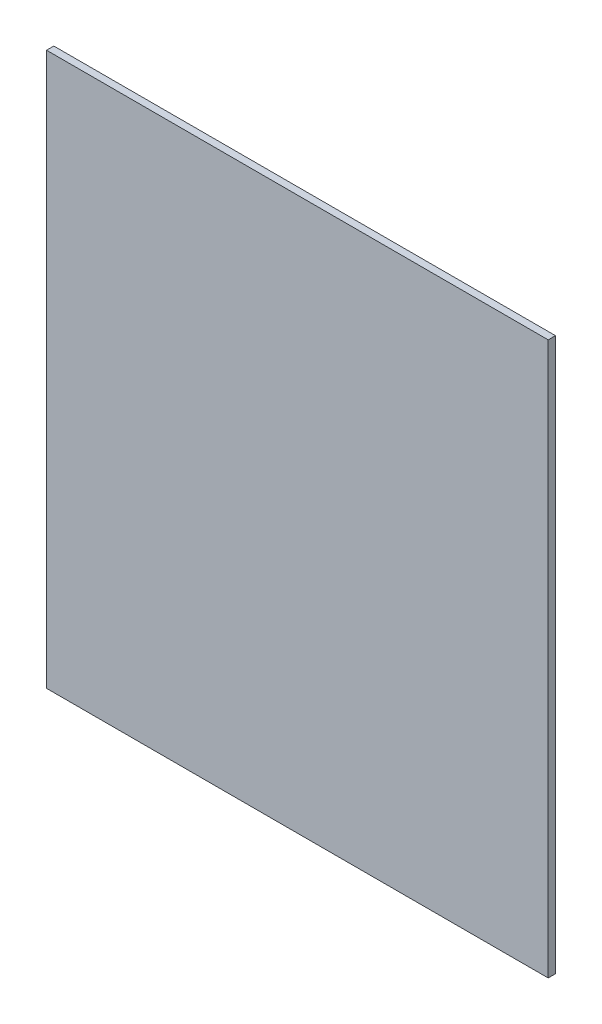
from build123d import *

# Parameters (mm, degrees)
SKETCH1_W           = 68.930158462
SKETCH1_H           = 75.930158462
BOSS_EXTRUDE1_DEPTH = 1
SKETCH2_W           = 24
SKETCH2_H           = 4
BOSS_EXTRUDE2_DEPTH = 5


with BuildPart() as part:
    # Sketch1 → Boss-Extrude1 (new body)
    with BuildSketch(Plane.XY):
        with Locations((5.5, -31.8)):
            Rectangle(SKETCH1_W, SKETCH1_H)
    extrude(amount=BOSS_EXTRUDE1_DEPTH)

    # Sketch2 → Boss-Extrude2 (add)
    with BuildSketch(Plane(origin=(0, 0, 0), x_dir=(-1, 0, 0), z_dir=(0, 0, -1))):
        with Locations((-6.534920769, -62.465079231)):
            Rectangle(SKETCH2_W, SKETCH2_H)
    extrude(amount=BOSS_EXTRUDE2_DEPTH)


solid = part.part
